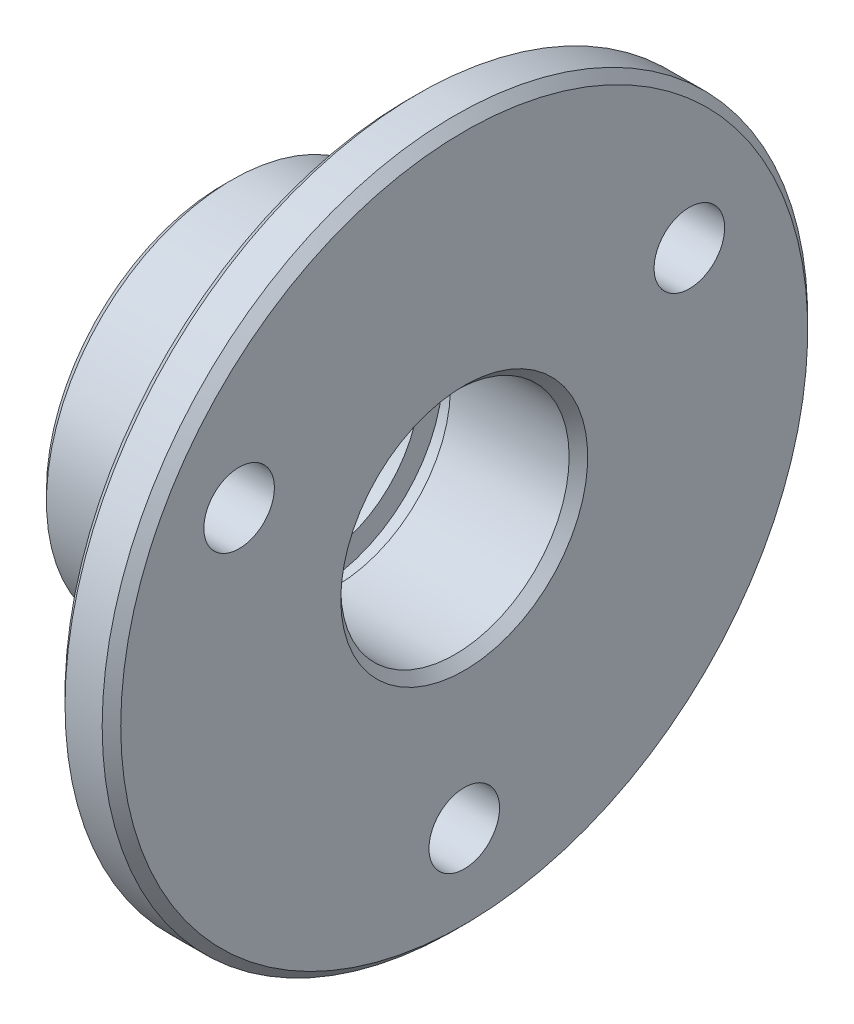
from build123d import *

# Parameters (mm, degrees)
SKETCH2_R                       = 10
BOSS_EXTRUDE1_DEPTH             = 13
F_11_0_11_M12X0_5_TAPPED_HOLE_D = 11
CHAMFER1_SIZE                   = 0.5
CUT_EXTRUDE8_START              = -7.895
SKETCH4_R                       = 6.15
CUT_EXTRUDE8_DEPTH              = 7.895
SKETCH5_R                       = 6.75
CUT_EXTRUDE9_DEPTH              = 1
SKETCH6_R                       = 19
SKETCH6_R_2                     = 6.15
BOSS_EXTRUDE2_DEPTH             = 3
CHAMFER2_SIZE                   = 0.5
M3_TAPPED_HOLE1_REACH           = 37.359
M3_TAPPED_HOLE1_BORE_R          = 1.25
F_3_8_3_8_DIAMETER_HOLE1_D      = 3.8
CIRPATTERN1_COUNT               = 3
CHAMFER4_SIZE                   = 0.5


with BuildPart() as part:
    # Sketch2 → Boss-Extrude1 (new body)
    with BuildSketch(Plane(origin=(0, 0, 0), x_dir=(0, 0, -1), z_dir=(1, 0, 0))):
        with Locations(Location((0, 0, 0), (0, 0, 180))):
            Circle(SKETCH2_R)
    extrude(amount=BOSS_EXTRUDE1_DEPTH)

    # Ø11.0 (11) M12x0.5 tapped hole (through all)
    with Locations(Plane(origin=(0, 0, 0), x_dir=(0, 0, -1), z_dir=(-1, 0, 0))):
        with Locations((0, 0)):
            Hole(F_11_0_11_M12X0_5_TAPPED_HOLE_D / 2)

    # Chamfer1
    chamfer1_edges = [part.edges().sort_by_distance(p)[0] for p in [
        (0, 0, -5.5),
    ]]
    chamfer(chamfer1_edges, length=CHAMFER1_SIZE)

    # Sketch4 → Cut-Extrude8 (cut)
    with BuildSketch(Plane(origin=(13, 0, 0), x_dir=(0, 0, -1), z_dir=(1, 0, 0)).offset(CUT_EXTRUDE8_START)):
        Circle(SKETCH4_R)
    extrude(amount=CUT_EXTRUDE8_DEPTH, mode=Mode.SUBTRACT)

    # Sketch5 → Cut-Extrude9 (cut)
    with BuildSketch(Plane(origin=(5.105, 0, 0), x_dir=(0, 0, -1), z_dir=(1, 0, 0))):
        Circle(SKETCH5_R)
    extrude(amount=CUT_EXTRUDE9_DEPTH, mode=Mode.SUBTRACT)

    # Sketch6 → Boss-Extrude2 (add)
    with BuildSketch(Plane(origin=(10, 0, 0), x_dir=(0, 0, -1), z_dir=(1, 0, 0))):
        Circle(SKETCH6_R)
        Circle(SKETCH6_R_2, mode=Mode.SUBTRACT)
    extrude(amount=BOSS_EXTRUDE2_DEPTH)

    # Chamfer2
    chamfer2_edges = [part.edges().sort_by_distance(p)[0] for p in [
        (13, 0, 6.15),
    ]]
    chamfer(chamfer2_edges, length=CHAMFER2_SIZE)

    # M3 Tapped Hole1 bore (on position points) → M3 Tapped Hole1 (cut, up to next)
    with BuildSketch(Plane(origin=(6.9465, 10, 0), x_dir=(0, 0, 1), z_dir=(0, 1, 0)), mode=Mode.PRIVATE) as m3_tapped_hole1_sk1:
        Circle(M3_TAPPED_HOLE1_BORE_R)
    m3_tapped_hole1_tool1 = extrude(m3_tapped_hole1_sk1.sketch, amount=-M3_TAPPED_HOLE1_REACH, mode=Mode.PRIVATE) & part.part
    add(m3_tapped_hole1_tool1.solids().sort_by_distance((6.9465, 10, 0))[0], mode=Mode.SUBTRACT)

    # Ø3.8 (3.8) Diameter Hole1 (through all)
    with Locations(Plane(origin=(13, -14, 0), x_dir=(0, 0, 1), z_dir=(1, 0, 0))):
        with Locations((0, 0)):
            f_3_8_3_8_diameter_hole1 = Hole(F_3_8_3_8_DIAMETER_HOLE1_D / 2)

    # CirPattern1: Ø3.8 (3.8) Diameter Hole1 ×3 about axis
    cirpattern1_axis = Axis((0, 0, 0), (1, 0, 0))
    for i in range(1, CIRPATTERN1_COUNT):
        add(f_3_8_3_8_diameter_hole1.rotate(cirpattern1_axis, i * 360 / CIRPATTERN1_COUNT), mode=Mode.SUBTRACT)

    # Chamfer4
    chamfer4_edges = [part.edges().sort_by_distance(p)[0] for p in [
        (0, 0, -10),
        (13, 0, 19),
        (10, 0, 19),
    ]]
    chamfer(chamfer4_edges, length=CHAMFER4_SIZE)


solid = part.part
